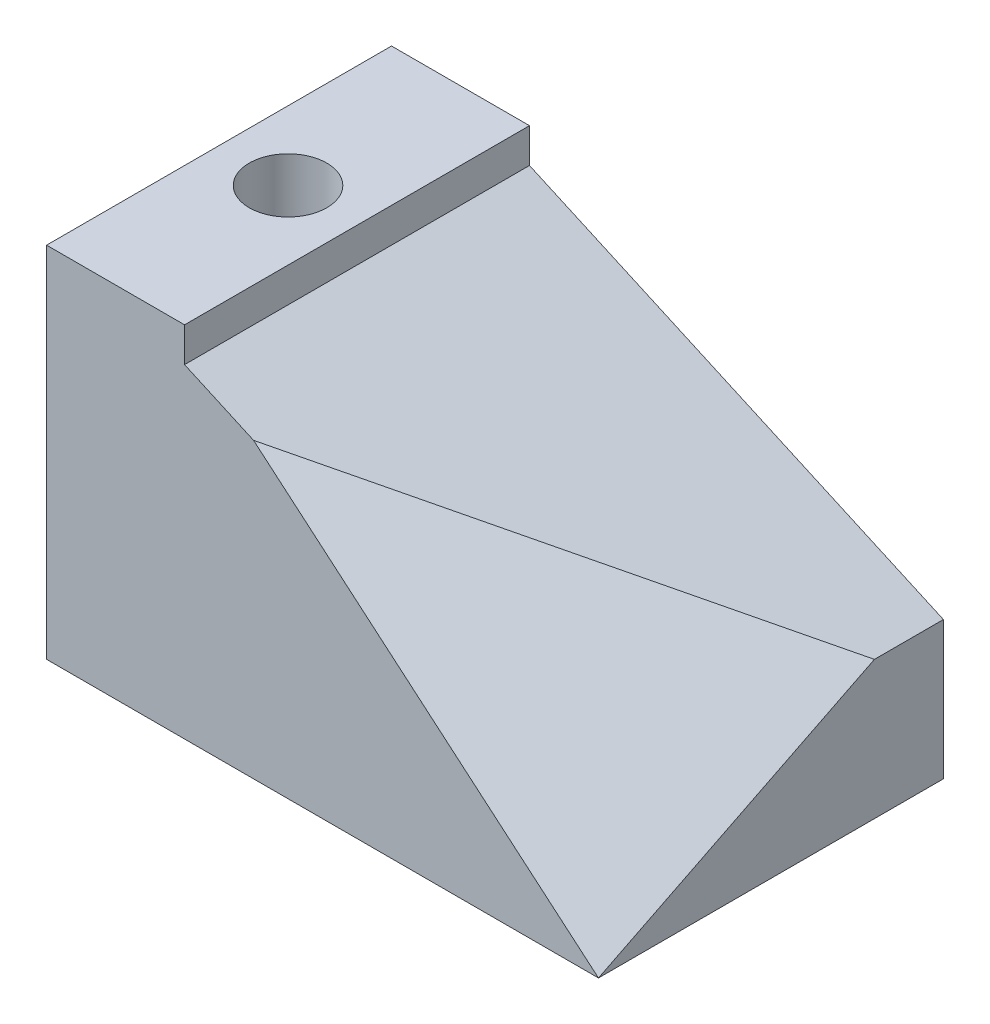
from build123d import *

# Parameters (mm, degrees)
SALIENTE_EXTRUIR1_DEPTH = 63.5
CROQUIS4_R              = 7.1374
CORTAR_EXTRUIR1_DEPTH   = 38.1
CORTAR_EXTRUIR2_DEPTH   = 153.516992536


with BuildPart() as part:
    # Croquis3 → Saliente-Extruir1 (new body)
    with BuildSketch(Plane.XY):
        Polygon((0, 0), (101.6, 0), (101.6, 25.4), (25.4, 59.69), (25.4, 66.04), (0, 66.04), align=None)
    extrude(amount=SALIENTE_EXTRUIR1_DEPTH)

    # Croquis4 → Cortar-Extruir1 (cut)
    with BuildSketch(Plane(origin=(0, 66.04, 0), x_dir=(1, 0, 0), z_dir=(0, 1, 0))):
        with Locations(Location((12.7, -31.75, 0), (0, 0, 270))):
            Circle(CROQUIS4_R)
    extrude(amount=-CORTAR_EXTRUIR1_DEPTH, mode=Mode.SUBTRACT)

    # Croquis3D1 → Cortar-Extruir2 (cut, through all, along a direction that is not the sketch's normal)
    with BuildSketch(Plane(origin=(101.6, 0, 63.5), x_dir=(-0.7619393177594593, 0.6476484200955405, 0), z_dir=(-0.6052160263325688, -0.7120188545089043, -0.35600942725445217))):
        Polygon((0, 0), (16.45026987, 54.361646601), (83.339970152, 0), align=None)
    extrude(amount=-CORTAR_EXTRUIR2_DEPTH, dir=(-0.41036467732879794, -0.9119215051751064, 0), mode=Mode.SUBTRACT)


solid = part.part
